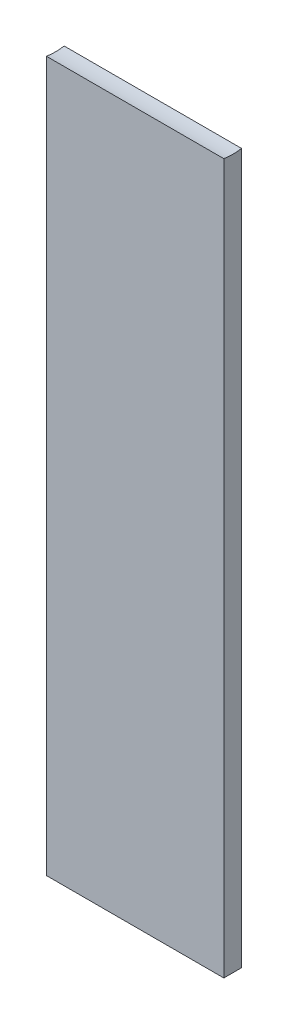
from build123d import *

# Parameters (mm, degrees)
SKETCH1_W           = 12.7
SKETCH1_H           = 1.27
BOSS_EXTRUDE1_DEPTH = 50.8
SKETCH4_R           = 3.81
CUT_EXTRUDE1_DEPTH  = 50.8


with BuildPart() as part:
    # Sketch1 → Boss-Extrude1 (new body)
    with BuildSketch(Plane(origin=(0, 0, 0), x_dir=(1, 0, 0), z_dir=(0, 1, 0))):
        Rectangle(SKETCH1_W, SKETCH1_H)
    extrude(amount=BOSS_EXTRUDE1_DEPTH)

    # Sketch4 → Cut-Extrude1 (cut)
    with BuildSketch(Plane(origin=(6.35, 0, 0), x_dir=(0, 0, -1), z_dir=(1, 0, 0))):
        with Locations((0, 54.556710662)):
            Circle(SKETCH4_R)
    extrude(amount=-CUT_EXTRUDE1_DEPTH, mode=Mode.SUBTRACT)


solid = part.part
